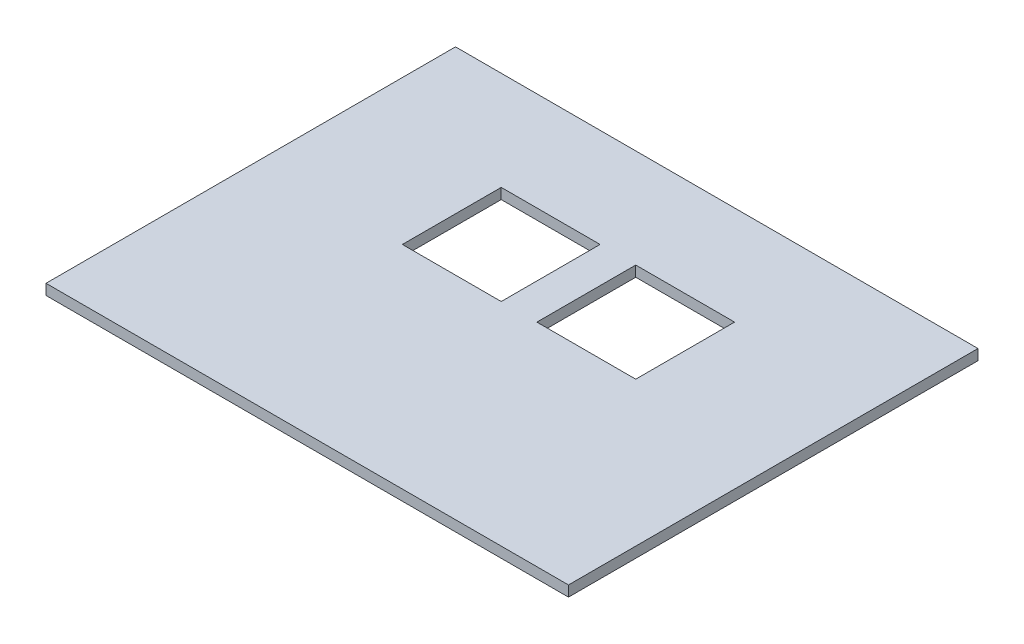
from build123d import *

# Parameters (mm, degrees)
IZIM1_W                     = 74
IZIM1_H                     = 58
Y_KSEKLIK_EKSTR_ZYON1_DEPTH = 1.5
IZIM2_W                     = 69.8
IZIM2_H                     = 53.8
IZIM2_W_2                   = 65.8
IZIM2_H_2                   = 49.8
EKSTR_ZYON_NCE1_DEPTH       = 2
IZIM4_W                     = 14
IZIM4_H                     = 14
KES_EKSTR_ZYON4_DEPTH       = 2


with BuildPart() as part:
    # Çizim1 → Yükseklik-Ekstrüzyon1 (new body)
    with BuildSketch(Plane(origin=(0, 0, 0), x_dir=(1, 0, 0), z_dir=(0, 1, 0))):
        Rectangle(IZIM1_W, IZIM1_H)
    extrude(amount=Y_KSEKLIK_EKSTR_ZYON1_DEPTH)

    # Çizim2 → Ekstrüzyon-İnce1 (add)
    with BuildSketch(Plane.XZ):
        Rectangle(IZIM2_W, IZIM2_H)
        Rectangle(IZIM2_W_2, IZIM2_H_2, mode=Mode.SUBTRACT)
    extrude(amount=EKSTR_ZYON_NCE1_DEPTH)

    # Çizim4 → Kes-Ekstrüzyon4 (cut)
    with BuildSketch(Plane(origin=(0, 1.5, 0), x_dir=(1, 0, 0), z_dir=(0, 1, 0))):
        with Locations((-9.525, 8)):
            Rectangle(IZIM4_W, IZIM4_H)
        with Locations((9.525, 8)):
            Rectangle(IZIM4_W, IZIM4_H)
    extrude(amount=-KES_EKSTR_ZYON4_DEPTH, mode=Mode.SUBTRACT)


solid = part.part
